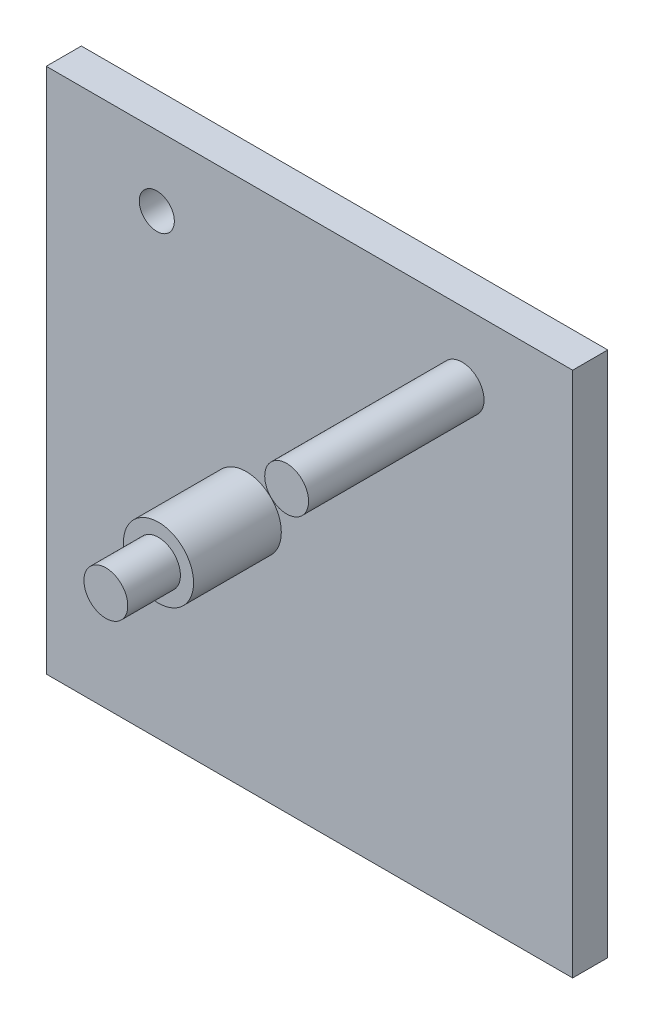
from build123d import *

# Parameters (mm, degrees)
SKETCH1_W           = 38.1
SKETCH1_H           = 38.1
BOSS_EXTRUDE1_DEPTH = 2.54
SKETCH2_R           = 1.5875
SKETCH2_R_2         = 1.27
BOSS_EXTRUDE2_DEPTH = 12.7
SKETCH5_R           = 1.27
CUT_EXTRUDE1_DEPTH  = 48.83102763
SKETCH6_R           = 2.54
BOSS_EXTRUDE3_DEPTH = 6.35
CUT_EXTRUDE2_START  = -2.54
SKETCH7_R           = 1.5875
CUT_EXTRUDE2_DEPTH  = 2.54


with BuildPart() as part:
    # Sketch1 → Boss-Extrude1 (new body)
    with BuildSketch(Plane.XY):
        with Locations((-19.05, 5.525182688)):
            Rectangle(SKETCH1_W, SKETCH1_H)
    extrude(amount=BOSS_EXTRUDE1_DEPTH)

    # Sketch2 → Boss-Extrude2 (add)
    with BuildSketch(Plane.XY.offset(2.54)):
        with Locations(Location((-8.001, 19.495182688, 0), (0, 0, 180))):
            Circle(SKETCH2_R)
        with Locations(Location((-23.626645651, 3.869537037, 0), (0, 0, 180))):
            Circle(SKETCH2_R)
        with Locations(Location((-30.099, 19.495182688, 0), (0, 0, 180))):
            Circle(SKETCH2_R_2)
    extrude(amount=BOSS_EXTRUDE2_DEPTH)

    # Sketch5 → Cut-Extrude1 (cut, through all)
    with BuildSketch(Plane.XY.offset(15.24)):
        with Locations((-30.099, 19.495182688)):
            Circle(SKETCH5_R)
    extrude(amount=-CUT_EXTRUDE1_DEPTH, mode=Mode.SUBTRACT)

    # Sketch6 → Boss-Extrude3 (add)
    with BuildSketch(Plane.XY.offset(2.54)):
        with Locations((-23.626645651, 3.869537037)):
            Circle(SKETCH6_R)
    extrude(amount=BOSS_EXTRUDE3_DEPTH)

    # Sketch7 → Cut-Extrude2 (cut)
    with BuildSketch(Plane.XY.offset(15.24).offset(CUT_EXTRUDE2_START)):
        with Locations(Location((-23.626645651, 3.869537037, 0), (0, 0, 180))):
            Circle(SKETCH7_R)
    extrude(amount=CUT_EXTRUDE2_DEPTH, mode=Mode.SUBTRACT)


solid = part.part
